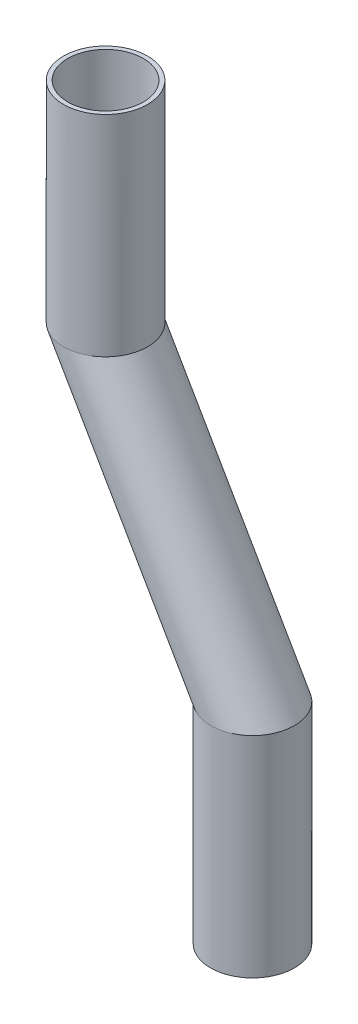
from build123d import *

# Parameters (mm, degrees)
SKETCH1_R           = 10
SKETCH1_R_2         = 9
BOSS_EXTRUDE1_DEPTH = 50
SKETCH2_R           = 10
SKETCH2_R_2         = 9
SKETCH4_R           = 10
SKETCH4_R_2         = 9


with BuildPart() as part:
    # Sketch1 → Boss-Extrude1 (new body)
    with BuildSketch(Plane(origin=(0, 0, 0), x_dir=(1, 0, 0), z_dir=(0, 1, 0))):
        with Locations(Location((0, 0, 0), (0, 0, 270))):
            Circle(SKETCH1_R)
        with Locations(Location((0, 0, 0), (0, 0, 270))):
            Circle(SKETCH1_R_2, mode=Mode.SUBTRACT)
    extrude(amount=BOSS_EXTRUDE1_DEPTH)

    # Sweep1: sweep along a path in Sketch3
    with BuildLine(Plane.XY) as sweep1_path:
        Line((0, 0), (35, -60.621778265))
    # Sketch2 → Sweep1 (sweep)
    with BuildSketch(Plane.XZ):
        Circle(SKETCH2_R)
        Circle(SKETCH2_R_2, mode=Mode.SUBTRACT)
    sweep(path=sweep1_path.line)

    # Sweep2: sweep along a path in Sketch5
    with BuildLine(Plane.XY) as sweep2_path:
        Line((35, -60.621778265), (35, -110.621778265))
    # Sketch4 → Sweep2 (sweep)
    with BuildSketch(Plane.XZ.offset(60.621778265)):
        with Locations((35, 0)):
            Circle(SKETCH4_R)
        with Locations((35, 0)):
            Circle(SKETCH4_R_2, mode=Mode.SUBTRACT)
    sweep(path=sweep2_path.line)


solid = part.part
